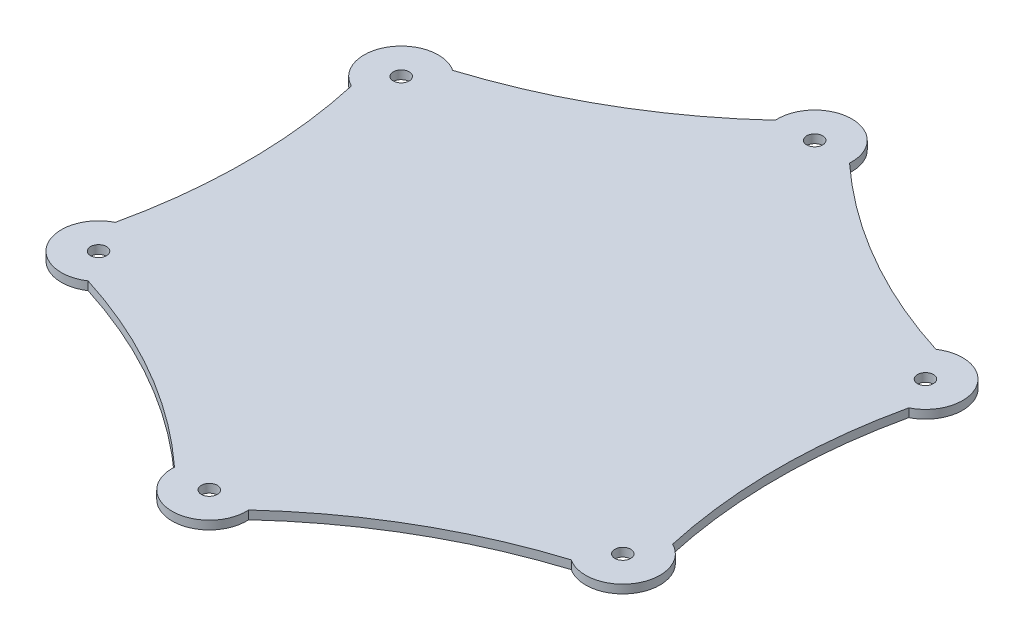
from build123d import *

# Parameters (mm, degrees)
ESBO_O1_R                = 1.5
RESSALTO_EXTRUS_O1_DEPTH = 1.6


with BuildPart() as part:
    # Esboço1 → Ressalto-extrusão1 (new body)
    with BuildSketch(Plane(origin=(0, 0, 0), x_dir=(1, 0, 0), z_dir=(0, 1, 0))):
        with BuildLine():
            ThreePointArc((-52.484604611, -22.234349076), (-50.025216279, 0), (-52.484604611, 22.234349076))
            ThreePointArc((-52.484604611, 22.234349076), (-55.425625842, 32), (-45.497813442, 34.335826363))
            ThreePointArc((-45.497813442, 34.335826363), (-25.01260814, 43.323108128), (-6.98679117, 56.570175439))
            ThreePointArc((-6.98679117, 56.570175439), (0, 64), (6.98679117, 56.570175439))
            ThreePointArc((6.98679117, 56.570175439), (25.01260814, 43.323108128), (45.497813442, 34.335826363))
            ThreePointArc((45.497813442, 34.335826363), (55.425625842, 32), (52.484604611, 22.234349076))
            ThreePointArc((52.484604611, 22.234349076), (50.025216279, 0), (52.484604611, -22.234349076))
            ThreePointArc((52.484604611, -22.234349076), (55.425625842, -32), (45.497813442, -34.335826363))
            ThreePointArc((45.497813442, -34.335826363), (25.01260814, -43.323108128), (6.98679117, -56.570175439))
            ThreePointArc((6.98679117, -56.570175439), (0, -64), (-6.98679117, -56.570175439))
            ThreePointArc((-6.98679117, -56.570175439), (-25.01260814, -43.323108128), (-45.497813442, -34.335826363))
            ThreePointArc((-45.497813442, -34.335826363), (-55.425625842, -32), (-52.484604611, -22.234349076))
        make_face()
        with Locations(Location((-49.363448016, 28.5, 0), (0, 0, 270))):
            Circle(ESBO_O1_R, mode=Mode.SUBTRACT)
        with Locations(Location((-49.363448016, -28.5, 0), (0, 0, 270))):
            Circle(ESBO_O1_R, mode=Mode.SUBTRACT)
        with Locations(Location((0, -57, 0), (0, 0, 270))):
            Circle(ESBO_O1_R, mode=Mode.SUBTRACT)
        with Locations(Location((49.363448016, -28.5, 0), (0, 0, 270))):
            Circle(ESBO_O1_R, mode=Mode.SUBTRACT)
        with Locations(Location((49.363448016, 28.5, 0), (0, 0, 270))):
            Circle(ESBO_O1_R, mode=Mode.SUBTRACT)
        with Locations(Location((0, 57, 0), (0, 0, 270))):
            Circle(ESBO_O1_R, mode=Mode.SUBTRACT)
    extrude(amount=RESSALTO_EXTRUS_O1_DEPTH)


solid = part.part
